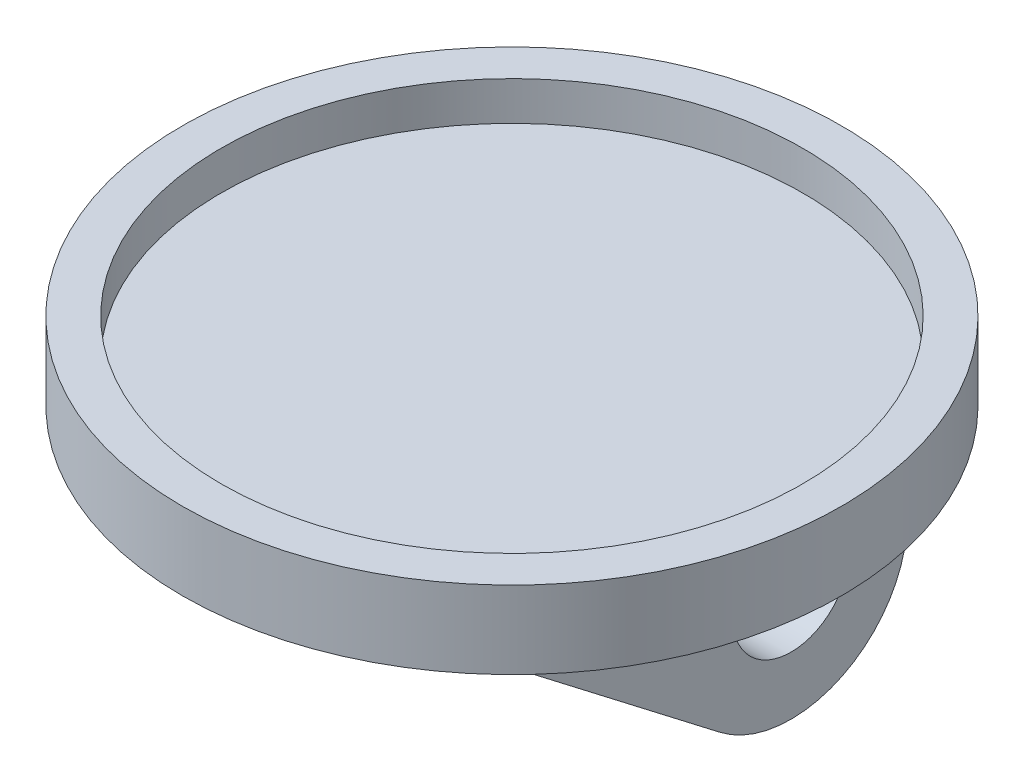
from build123d import *

# Parameters (mm, degrees)
CONNECTOR_PLATE_SKETCH_R      = 85
CONNECTOR_PLATE_EXTRUDE_DEPTH = 20
CONNECTOR_PLATE_SHELL_T       = -10
TRIANGLE_START                = 17
TRIANGLE_SKETCH_R             = 15
TRIANGLE_EXTRUDE_1_DEPTH      = 20
TRIANGLE_START_2              = -37
TRIANGLE_SKETCH_3_R           = 15
TRIANGLE_EXTRUDE_2_DEPTH      = 20
TRIANGLE_FILLET_R             = 30


with BuildPart() as part:
    # Connector Plate Sketch → Connector Plate Extrude (new body)
    with BuildSketch(Plane(origin=(0, 0, 0), x_dir=(1, 0, 0), z_dir=(0, 1, 0))):
        Circle(CONNECTOR_PLATE_SKETCH_R)
    extrude(amount=CONNECTOR_PLATE_EXTRUDE_DEPTH)

    # Connector Plate Shell
    connector_plate_shell_openings = [part.faces().sort_by_distance(p)[0] for p in [
        (0, 20, 0),
    ]]
    offset(amount=CONNECTOR_PLATE_SHELL_T, openings=connector_plate_shell_openings, kind=Kind.INTERSECTION)

    # Triangle Sketch → Triangle Extrude 1 (add)
    with BuildSketch(Plane(origin=(0, 0, 0), x_dir=(0, 0, -1), z_dir=(1, 0, 0)).offset(TRIANGLE_START)):
        Polygon((65, -100), (-65, 0), (65, 0), align=None)
        with Locations((35, -39.074108923)):
            Circle(TRIANGLE_SKETCH_R, mode=Mode.SUBTRACT)
    extrude(amount=TRIANGLE_EXTRUDE_1_DEPTH)

    # Triangle Sketch<3> → Triangle Extrude 2 (add)
    with BuildSketch(Plane(origin=(0, 0, 0), x_dir=(0, 0, -1), z_dir=(1, 0, 0)).offset(TRIANGLE_START_2)):
        Polygon((65, -100), (-65, 0), (65, 0), align=None)
        with Locations((35, -39.074108923)):
            Circle(TRIANGLE_SKETCH_3_R, mode=Mode.SUBTRACT)
    extrude(amount=TRIANGLE_EXTRUDE_2_DEPTH)

    # Triangle Fillet
    triangle_fillet_edges = [part.edges().sort_by_distance(p)[0] for p in [
        (27, -100, -65),
        (-27, -100, -65),
    ]]
    fillet(triangle_fillet_edges, radius=TRIANGLE_FILLET_R)


solid = part.part
